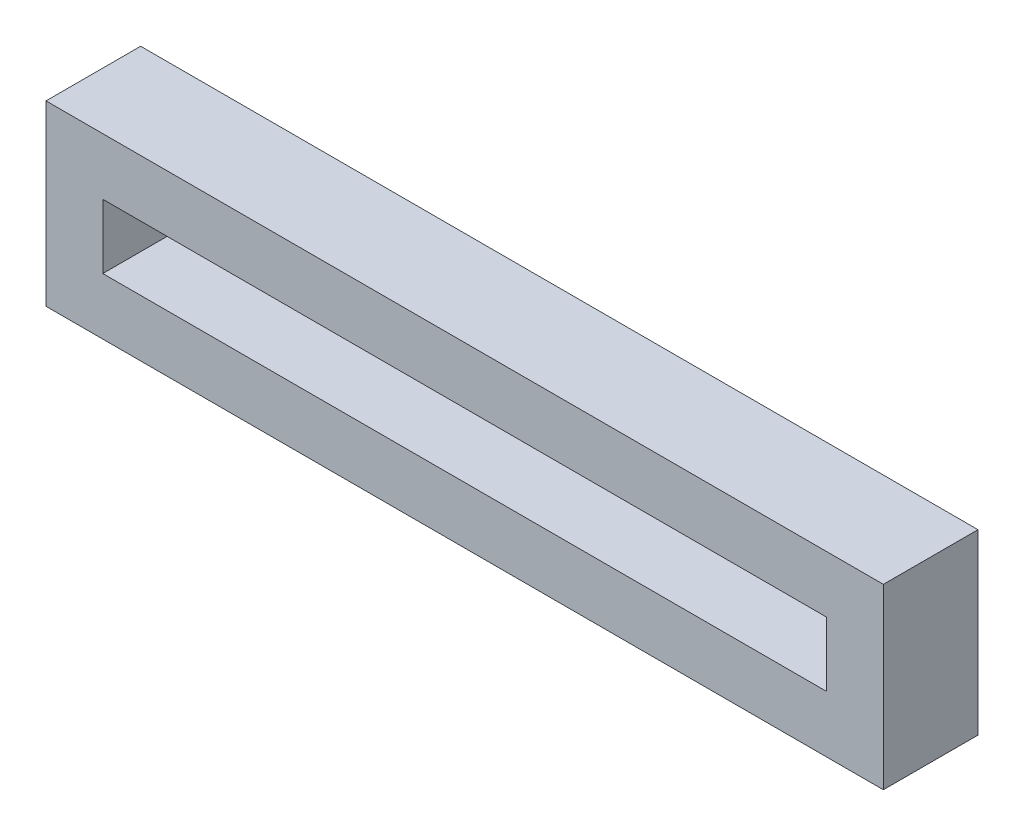
from build123d import *

# Parameters (mm, degrees)
SKETCH1_W           = 56.1848
SKETCH1_H           = 11.938
SKETCH1_W_2         = 48.5648
SKETCH1_H_2         = 4.318
BOSS_EXTRUDE1_DEPTH = 6.35


with BuildPart() as part:
    # Sketch1 → Boss-Extrude1 (new body)
    with BuildSketch(Plane.XY):
        with Locations((28.78455, 16.941165)):
            Rectangle(SKETCH1_W, SKETCH1_H)
        with Locations((28.78455, 16.941165)):
            Rectangle(SKETCH1_W_2, SKETCH1_H_2, mode=Mode.SUBTRACT)
    extrude(amount=BOSS_EXTRUDE1_DEPTH)


solid = part.part
